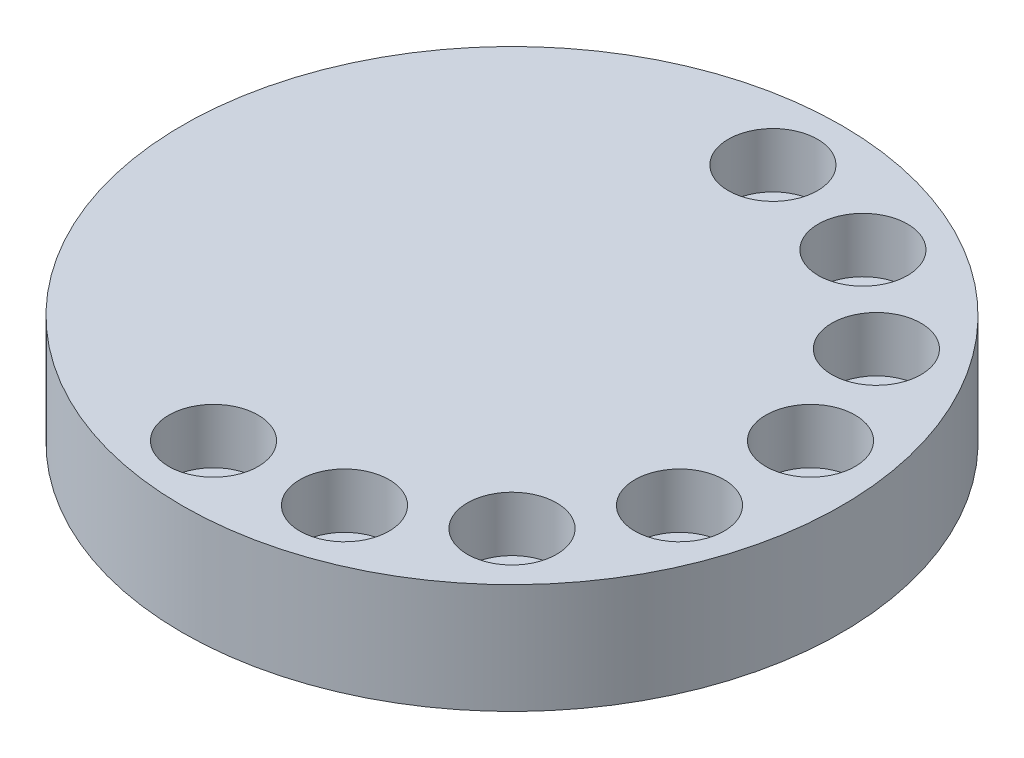
from build123d import *

# Parameters (mm, degrees)
SKETCH1_R                                        = 76.2
BOSS_EXTRUDE1_DEPTH                              = 25.4
CBORE_FOR_1_2_SOCKET_HEAD_CAP_SCREW1_D           = 13.49248
CBORE_FOR_1_2_SOCKET_HEAD_CAP_SCREW1_CBORE_D     = 20.6375
CBORE_FOR_1_2_SOCKET_HEAD_CAP_SCREW1_CBORE_DEPTH = 12.7
CIRPATTERN1_COUNT                                = 8
CIRPATTERN1_ANGLE                                = 189


with BuildPart() as part:
    # Sketch1 → Boss-Extrude1 (new body)
    with BuildSketch(Plane(origin=(0, 0, 0), x_dir=(1, 0, 0), z_dir=(0, 1, 0))):
        with Locations(Location((0, 0, 0), (0, 0, 270))):
            Circle(SKETCH1_R)
    extrude(amount=BOSS_EXTRUDE1_DEPTH)

    # CBORE for 1/2 Socket Head Cap Screw1 (through all)
    with Locations(Plane(origin=(0, 25.4, 0), x_dir=(1, 0, 0), z_dir=(0, 1, 0))):
        with Locations((0, 60.325)):
            cbore_for_1_2_socket_head_cap_screw1 = CounterBoreHole(CBORE_FOR_1_2_SOCKET_HEAD_CAP_SCREW1_D / 2, CBORE_FOR_1_2_SOCKET_HEAD_CAP_SCREW1_CBORE_D / 2, CBORE_FOR_1_2_SOCKET_HEAD_CAP_SCREW1_CBORE_DEPTH)

    # CirPattern1: CBORE for 1/2 Socket Head Cap Screw1 ×8 about axis
    cirpattern1_axis = Axis((0, 0, 0), (0, -1, 0))
    for i in range(1, CIRPATTERN1_COUNT):
        add(cbore_for_1_2_socket_head_cap_screw1.rotate(cirpattern1_axis, i * CIRPATTERN1_ANGLE / (CIRPATTERN1_COUNT - 1)), mode=Mode.SUBTRACT)


solid = part.part
